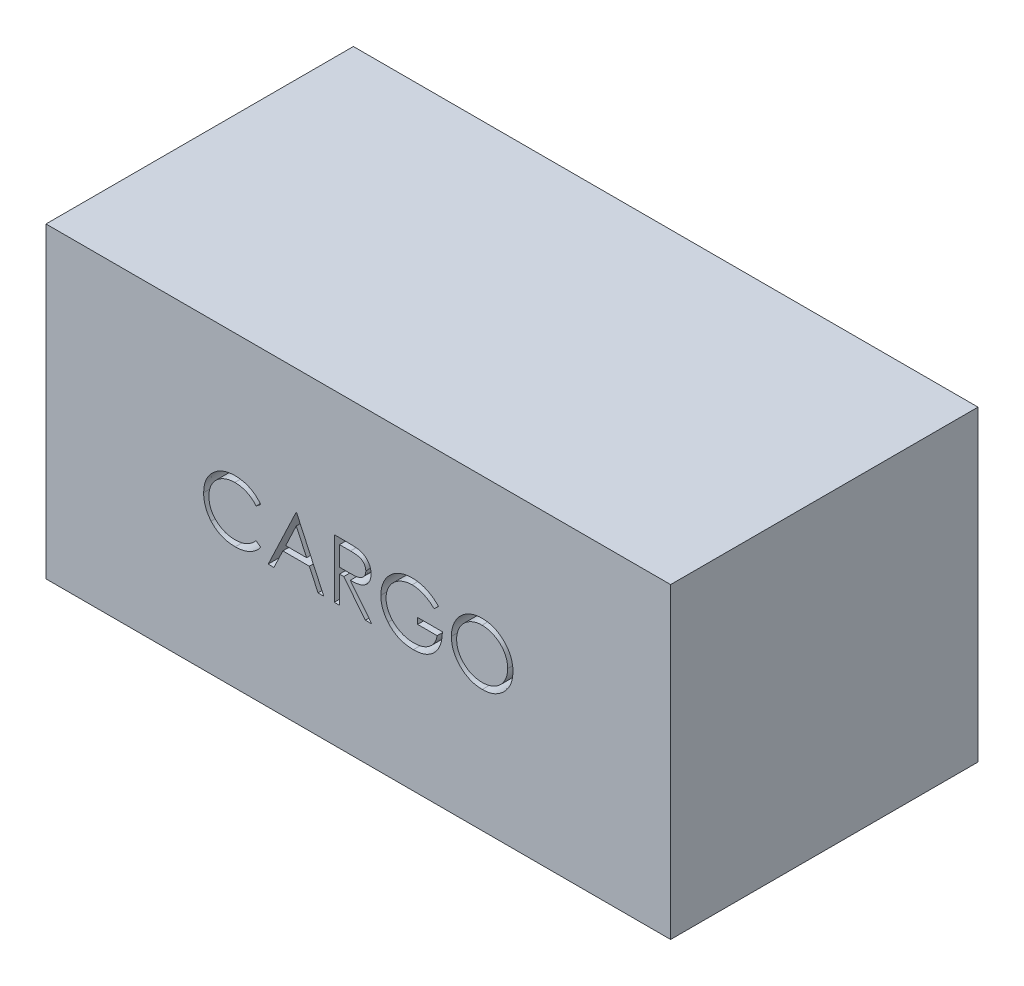
from build123d import *

# Parameters (mm, degrees)
SKETCH1_W           = 203.2
SKETCH1_H           = 100
BOSS_EXTRUDE1_DEPTH = 100
CUT_EXTRUDE1_DEPTH  = 10


with BuildPart() as part:
    # Sketch1 → Boss-Extrude1 (new body)
    with BuildSketch(Plane(origin=(0, 0, 0), x_dir=(1, 0, 0), z_dir=(0, 1, 0))):
        with Locations((32.552380952, -19.217687075)):
            Rectangle(SKETCH1_W, SKETCH1_H)
    extrude(amount=BOSS_EXTRUDE1_DEPTH)

    # Sketch2 → Cut-Extrude1 (cut)
    # profile 1 of 5: a face of its own
    with BuildSketch(Plane.XY.offset(69.217687075)):
        with BuildLine():
            Line((0.79814617, 55.858937578), (-0.697767292, 54.714105847))
            add(Edge.make_bspline(
                [(-0.697767292, 54.714105847), (-0.804479341, 54.841283483), (-1.016464731, 55.093924124), (-1.357509819, 55.448687073), (-1.712937332, 55.781056568), (-2.082611406, 56.092615941), (-2.473186042, 56.372470052), (-2.875199818, 56.635202769), (-3.29537775, 56.870702886), (-3.876412191, 57.156251424), (-4.636495479, 57.454226925), (-5.593321675, 57.704071656), (-6.592146368, 57.86311834), (-7.273579018, 57.88034412), (-7.620183157, 57.889105847)],
                knots=[0, 0, 0, 0, 0.757959112, 1.505699292, 2.245454638, 2.979532153, 3.711538275, 4.438200793, 5.171680507, 5.909471876, 7.393775596, 8.890124382, 10.418191784, 12, 12, 12, 12], degree=3))
            add(Edge.make_bspline(
                [(-7.620183157, 57.889105847), (-7.811136544, 57.886907137), (-8.191271089, 57.882530123), (-8.755414923, 57.82478617), (-9.30902453, 57.743626584), (-9.851739796, 57.62320161), (-10.382869899, 57.47095064), (-10.905887116, 57.289020887), (-11.413219095, 57.063932402), (-11.911884077, 56.815148873), (-12.389653783, 56.534148066), (-12.841710543, 56.227642537), (-13.266405626, 55.899062169), (-13.664074986, 55.547175433), (-14.035125162, 55.173567048), (-14.376867525, 54.774255417), (-14.688119544, 54.350517159), (-14.97505078, 53.907939898), (-15.232022943, 53.447812775), (-15.447178429, 52.968432748), (-15.637706309, 52.478008988), (-15.78846933, 51.971000526), (-15.907801343, 51.450974901), (-15.990139053, 50.916536469), (-16.047226303, 50.368801728), (-16.051581552, 49.997548183), (-16.053776907, 49.810409934)],
                knots=[0, 0, 0, 0, 1.054917814, 2.100044995, 3.131103042, 4.146048494, 5.169673617, 6.183595914, 7.203665975, 8.234915748, 9.262203917, 10.264457458, 11.251630812, 12.227803204, 13.197192746, 14.159520551, 15.12972552, 16.100847026, 17.073214652, 18.039054194, 19.002613845, 19.979014051, 20.95965708, 21.949030935, 22.966165397, 24, 24, 24, 24], degree=3))
            add(Edge.make_bspline(
                [(-16.053776907, 49.810409934), (-16.046909007, 49.52884375), (-16.033424795, 48.976025895), (-15.913418862, 48.166288715), (-15.731055437, 47.390569047), (-15.457739225, 46.653715906), (-15.120722678, 45.946643271), (-14.694870207, 45.281314655), (-14.201657339, 44.647675925), (-13.634106571, 44.060702166), (-13.011412058, 43.524506033), (-12.343312711, 43.052335011), (-11.631472516, 42.658735436), (-10.883751143, 42.331206356), (-10.094394723, 42.079437595), (-9.264822727, 41.902195723), (-8.396839438, 41.786577569), (-7.803734562, 41.775508495), (-7.501883878, 41.769875078)],
                knots=[0, 0, 0, 0, 1.029171465, 2.020641659, 2.987623507, 3.938342917, 4.889210282, 5.84687017, 6.821220943, 7.821438502, 8.827599549, 9.822697543, 10.807740252, 11.797342354, 12.80366471, 13.83203677, 14.896651826, 16, 16, 16, 16], degree=3))
            add(Edge.make_bspline(
                [(-7.501883878, 41.769875078), (-7.169310671, 41.779066865), (-6.514727041, 41.7971585), (-5.554781069, 41.950425271), (-4.635832116, 42.198934795), (-3.757830753, 42.546722058), (-2.923252178, 42.998834553), (-2.130790356, 43.546918715), (-1.379776379, 44.196188069), (-0.928175543, 44.691940524), (-0.697767292, 44.944875078)],
                knots=[0, 0, 0, 0, 1.028121516, 2.023589091, 2.998037872, 3.967518031, 4.937445131, 5.927275754, 6.942489185, 8, 8, 8, 8], degree=3))
            Line((-0.697767292, 44.944875078), (0.79814617, 43.811491664))
            add(Edge.make_bspline(
                [(0.79814617, 43.811491664), (0.677760457, 43.656160948), (0.437565673, 43.346243539), (0.048629895, 42.90933609), (-0.361093681, 42.498378412), (-0.794648331, 42.116683787), (-1.247046597, 41.756614482), (-1.726411611, 41.428400229), (-2.226441631, 41.127459844), (-2.745442437, 40.851904727), (-3.282862601, 40.607426568), (-3.838058169, 40.398128203), (-4.408636015, 40.217834161), (-4.994622225, 40.069505763), (-5.597232273, 39.953730292), (-6.214291568, 39.876334633), (-6.847131889, 39.823310785), (-7.274077338, 39.818477986), (-7.490435561, 39.816028924)],
                knots=[0, 0, 0, 0, 0.986787822, 1.968848986, 2.935600012, 3.899624008, 4.868462664, 5.837806735, 6.815139263, 7.798259679, 8.787526145, 9.778297419, 10.776456485, 11.791383307, 12.812564526, 13.85620153, 14.913611965, 16, 16, 16, 16], degree=3))
            add(Edge.make_bspline(
                [(-7.490435561, 39.816028924), (-7.695324663, 39.817454912), (-8.100467491, 39.820274627), (-8.698630696, 39.865951995), (-9.2809597, 39.928271278), (-9.845790164, 40.022106848), (-10.396204399, 40.132838185), (-10.927212724, 40.281271739), (-11.444040368, 40.447546488), (-11.944610909, 40.642972202), (-12.429350132, 40.863495995), (-12.896694591, 41.112732909), (-13.346429344, 41.388587058), (-13.782975992, 41.6849779), (-14.199885697, 42.011425786), (-14.600771314, 42.36339704), (-14.987880792, 42.739705355), (-15.22738112, 43.0110582), (-15.34779734, 43.147489261)],
                knots=[0, 0, 0, 0, 1.114604814, 2.203992996, 3.262667896, 4.300477797, 5.318619304, 6.316056647, 7.298880507, 8.271930387, 9.238335007, 10.195173496, 11.151986948, 12.108099108, 13.064862484, 14.031167946, 15.010108607, 16, 16, 16, 16], degree=3))
            add(Edge.make_bspline(
                [(-15.34779734, 43.147489261), (-15.540668485, 43.384477732), (-15.924082266, 43.855593541), (-16.414623487, 44.619150096), (-16.834526609, 45.416355633), (-17.174029835, 46.251398388), (-17.439438425, 47.122404596), (-17.623304644, 48.029813325), (-17.742784091, 48.972777124), (-17.756447235, 49.614145931), (-17.763392292, 49.94015753)],
                knots=[0, 0, 0, 0, 0.994628077, 1.977248131, 2.950237994, 3.925870899, 4.908910175, 5.911660606, 6.938484602, 8, 8, 8, 8], degree=3))
            add(Edge.make_bspline(
                [(-17.763392292, 49.94015753), (-17.754927596, 50.28281507), (-17.738273834, 50.956972388), (-17.596782433, 51.946342048), (-17.369168699, 52.894223233), (-17.04587992, 53.798846471), (-16.636003651, 54.664969854), (-16.129673081, 55.485976983), (-15.532770493, 56.267118421), (-14.849977303, 56.996541568), (-14.101217949, 57.663505758), (-13.299382691, 58.250279524), (-12.446040951, 58.738599147), (-11.550593787, 59.146792545), (-10.606336006, 59.460543123), (-9.615282239, 59.680179754), (-8.579294718, 59.81688863), (-7.872472087, 59.834170833), (-7.513332196, 59.842952001)],
                knots=[0, 0, 0, 0, 1.032925535, 2.032216505, 3.007276963, 3.968222605, 4.92396291, 5.891752235, 6.871517503, 7.883894988, 8.900124299, 9.891468569, 10.874487609, 11.85992873, 12.854644235, 13.869047385, 14.917252991, 16, 16, 16, 16], degree=3))
            add(Edge.make_bspline(
                [(-7.513332196, 59.842952001), (-7.29445057, 59.840327792), (-6.861196435, 59.835133434), (-6.220285569, 59.784481432), (-5.596303761, 59.700043089), (-4.98882113, 59.585111338), (-4.394882319, 59.442468631), (-3.819026723, 59.256647864), (-3.257875298, 59.044177601), (-2.714967127, 58.799475094), (-2.192907047, 58.52479183), (-1.691857656, 58.223172507), (-1.215798925, 57.894991051), (-0.76138105, 57.543038625), (-0.336205673, 57.159869324), (0.071798946, 56.756022409), (0.4487771, 56.319865452), (0.681476633, 56.012861454), (0.79814617, 55.858937578)],
                knots=[0, 0, 0, 0, 1.096760587, 2.17092713, 3.219439832, 4.250915756, 5.268269357, 6.278326846, 7.281116186, 8.274029601, 9.260640565, 10.235837813, 11.203064059, 12.156899882, 13.114053108, 14.069676657, 15.032185724, 16, 16, 16, 16], degree=3))
        make_face()
    # profile 2 of 5: a face of its own
    with BuildSketch(Plane.XY.offset(69.217687075)):
        Polygon((12.521223093, 59.354490462), (21.313530785, 40.304490462), (19.455087275, 40.304490462), (16.638801218, 46.410259693), (8.002953862, 46.410259693), (5.110345689, 40.304490462), (3.240453862, 40.304490462), (12.276992323, 59.354490462), align=None)
        Polygon((12.380027179, 55.637603443), (8.93408367, 48.364105847), (15.738200256, 48.364105847), align=None, mode=Mode.SUBTRACT)
    # profile 3 of 5: a face of its own
    with BuildSketch(Plane.XY.offset(69.217687075)):
        with BuildLine():
            Line((24.732761554, 59.354490462), (28.545051218, 59.354490462))
            add(Edge.make_bspline(
                [(28.545051218, 59.354490462), (28.799456503, 59.35364363), (29.287942832, 59.352017618), (29.987748775, 59.342951109), (30.623621974, 59.316964973), (31.195229957, 59.29460254), (31.702562236, 59.253824973), (32.14717449, 59.214850594), (32.527018958, 59.163831098), (32.756957091, 59.116448724), (32.861066843, 59.09499527)],
                knots=[0, 0, 0, 0, 1.410062039, 2.707475311, 3.878576406, 4.937260626, 5.877586885, 6.699081471, 7.410979367, 8, 8, 8, 8], degree=3))
            add(Edge.make_bspline(
                [(32.861066843, 59.09499527), (33.00044004, 59.06055959), (33.276213225, 58.992422837), (33.673270013, 58.848407009), (34.051626548, 58.681748767), (34.409711163, 58.486003375), (34.745730255, 58.259717788), (35.06314849, 58.006798436), (35.363406226, 57.728629216), (35.634360528, 57.418196722), (35.88984308, 57.092515147), (36.105318319, 56.740341842), (36.291063873, 56.372069814), (36.438949115, 55.983953726), (36.5580278, 55.57975751), (36.641990617, 55.155819917), (36.692343509, 54.714072324), (36.697469895, 54.412767135), (36.700069247, 54.259989261)],
                knots=[0, 0, 0, 0, 1.027469482, 2.033020251, 3.019912614, 3.986113645, 4.951240523, 5.91722682, 6.890402269, 7.87763091, 8.8651537, 9.85103654, 10.82876324, 11.815024772, 12.821070561, 13.842952187, 14.906261191, 16, 16, 16, 16], degree=3))
            add(Edge.make_bspline(
                [(36.700069247, 54.259989261), (36.6920737, 54.006161048), (36.676472317, 53.510876463), (36.531011395, 52.792087951), (36.292742052, 52.12158611), (35.964411008, 51.500215181), (35.546293576, 50.94008724), (35.043782927, 50.448104905), (34.456598727, 50.036407666), (33.909976308, 49.750914543), (33.427117592, 49.568073141), (33.029607704, 49.439423816), (32.595991727, 49.340026548), (32.130424234, 49.250980688), (31.630967766, 49.18375218), (31.098819409, 49.134512858), (30.533599641, 49.103738679), (30.145311278, 49.099155767), (29.945562035, 49.096798155)],
                knots=[0, 0, 0, 0, 1.260483769, 2.459530307, 3.627416485, 4.787058657, 5.939039949, 7.08810263, 8.267026773, 9.491475466, 10.141966685, 10.831826277, 11.566392101, 12.351337768, 13.187381173, 14.07005841, 15.007169909, 16, 16, 16, 16], degree=3))
            Line((29.945562035, 49.096798155), (36.944300016, 40.304490462))
            Line((36.944300016, 40.304490462), (34.83017742, 40.304490462))
            Line((34.83017742, 40.304490462), (27.831439439, 49.096798155))
            Line((27.831439439, 49.096798155), (26.442376939, 49.096798155))
            Line((26.442376939, 49.096798155), (26.442376939, 40.304490462))
            Line((26.442376939, 40.304490462), (24.732761554, 40.304490462))
            Line((24.732761554, 40.304490462), (24.732761554, 59.354490462))
        make_face()
        with BuildLine():
            Line((26.442376939, 57.400644309), (26.442376939, 51.050644309))
            Line((26.442376939, 51.050644309), (29.930297612, 51.023931568))
            add(Edge.make_bspline(
                [(29.930297612, 51.023931568), (30.093148109, 51.023859523), (30.408798756, 51.023719879), (30.865458089, 51.045457432), (31.290654697, 51.070186065), (31.682762219, 51.10801036), (32.041955822, 51.156756979), (32.368055971, 51.217733221), (32.661594982, 51.288773734), (33.003942741, 51.398728297), (33.386230148, 51.572932482), (33.801691379, 51.826381839), (34.155489818, 52.145165188), (34.454399897, 52.509692142), (34.694590088, 52.910483725), (34.863928555, 53.342735677), (34.971383848, 53.79553566), (34.984057789, 54.106747933), (34.990453862, 54.263805366)],
                knots=[0, 0, 0, 0, 1.146690395, 2.22261258, 3.21895312, 4.145990853, 4.996080663, 5.770904154, 6.481378293, 7.121626537, 8.300444488, 9.431385265, 10.535395872, 11.636531494, 12.74115979, 13.810798291, 14.895190096, 16, 16, 16, 16], degree=3))
            add(Edge.make_bspline(
                [(34.990453862, 54.263805366), (34.983910889, 54.417003146), (34.970945103, 54.720585245), (34.865088234, 55.1650267), (34.68607603, 55.5844911), (34.444836421, 55.977272082), (34.150926734, 56.333810445), (33.806296925, 56.638867092), (33.420370077, 56.890596321), (33.059665412, 57.051456592), (32.737262055, 57.150080365), (32.457337763, 57.219483128), (32.141045291, 57.275242309), (31.786848867, 57.319917612), (31.396260562, 57.358316665), (30.967305447, 57.384179918), (30.502829543, 57.399495378), (30.180901246, 57.400252419), (30.014251939, 57.400644309)],
                knots=[0, 0, 0, 0, 1.101028733, 2.181837193, 3.264309656, 4.369019818, 5.486613113, 6.575447106, 7.666700264, 8.788928104, 9.402425223, 10.0903467, 10.862060571, 11.710948788, 12.657782767, 13.684531032, 14.801375019, 16, 16, 16, 16], degree=3))
            Line((30.014251939, 57.400644309), (26.442376939, 57.400644309))
        make_face(mode=Mode.SUBTRACT)
    # profile 4 of 5: a face of its own
    with BuildSketch(Plane.XY.offset(69.217687075)):
        with BuildLine():
            Line((58.680838477, 56.103168347), (57.215453862, 54.714105847))
            add(Edge.make_bspline(
                [(57.215453862, 54.714105847), (56.950283914, 54.963556687), (56.426267146, 55.45651007), (55.571954968, 56.096105629), (54.680612903, 56.644016831), (53.756892027, 57.089820775), (52.823667613, 57.445526515), (51.893326702, 57.698772535), (50.975412242, 57.860275917), (50.364902096, 57.879589185), (50.06407165, 57.889105847)],
                knots=[0, 0, 0, 0, 1.08915593, 2.152340314, 3.188132944, 4.216796309, 5.218260357, 6.173443236, 7.099959455, 8, 8, 8, 8], degree=3))
            add(Edge.make_bspline(
                [(50.06407165, 57.889105847), (49.879478784, 57.886854649), (49.5107718, 57.882358092), (48.963100933, 57.824967435), (48.421173951, 57.742427246), (47.886013869, 57.623000741), (47.356580153, 57.471640002), (46.834714154, 57.282307695), (46.31944238, 57.061571294), (45.815618425, 56.806505545), (45.327173684, 56.526308095), (44.865854336, 56.215801038), (44.428719979, 55.884936339), (44.023986807, 55.525430293), (43.649326719, 55.140539384), (43.295822009, 54.737423389), (42.975905584, 54.305068842), (42.686937958, 53.851430506), (42.429155435, 53.384475876), (42.201596907, 52.908699461), (42.01056847, 52.425679339), (41.859423292, 51.934809402), (41.734723876, 51.439887191), (41.646998042, 50.937485784), (41.597540312, 50.427067239), (41.588985338, 50.085270733), (41.584684631, 49.913444789)],
                knots=[0, 0, 0, 0, 1.02818874, 2.053710826, 3.065248034, 4.081641283, 5.106893873, 6.131558223, 7.173050175, 8.228653731, 9.27666206, 10.308777013, 11.325269123, 12.329503258, 13.32196095, 14.316845687, 15.314881793, 16.315733098, 17.311955233, 18.285320748, 19.252783886, 20.203351036, 21.145449891, 22.095197417, 23.042428769, 24, 24, 24, 24], degree=3))
            add(Edge.make_bspline(
                [(41.584684631, 49.913444789), (41.588797898, 49.737799341), (41.597013199, 49.386988075), (41.649592938, 48.86341748), (41.74717379, 48.347622932), (41.877626605, 47.837909522), (42.040807902, 47.333404301), (42.244221984, 46.836294498), (42.485153324, 46.346598511), (42.764026558, 45.868728625), (43.069840037, 45.403239027), (43.412430234, 44.964765058), (43.776342839, 44.547467856), (44.174835636, 44.160612627), (44.595130573, 43.793851706), (45.049784818, 43.457289794), (45.52985821, 43.144444036), (46.036083178, 42.859257266), (46.562966894, 42.604485093), (47.103207221, 42.377932173), (47.658530046, 42.191354637), (48.226016971, 42.039291528), (48.804991493, 41.914648482), (49.398392476, 41.834461696), (50.001856789, 41.776273031), (50.408648486, 41.772018512), (50.613590881, 41.769875078)],
                knots=[0, 0, 0, 0, 0.93586088, 1.869166235, 2.799637598, 3.729985548, 4.670839027, 5.622275134, 6.589130586, 7.576015415, 8.568469353, 9.55398029, 10.53834874, 11.515998671, 12.510579167, 13.508179873, 14.527009472, 15.561807829, 16.601455013, 17.643573243, 18.680854198, 19.719860599, 20.772568776, 21.833555941, 22.908541556, 24, 24, 24, 24], degree=3))
            add(Edge.make_bspline(
                [(50.613590881, 41.769875078), (50.860578743, 41.775038043), (51.345579536, 41.785176365), (52.058520031, 41.864099368), (52.743248173, 41.987362631), (53.397839936, 42.167879869), (54.023055606, 42.398132728), (54.621187187, 42.675693332), (55.1875255, 43.011207696), (55.723773059, 43.389888315), (56.217751455, 43.811790475), (56.663271759, 44.267055295), (57.053227921, 44.753472915), (57.39343207, 45.268178417), (57.674874889, 45.815432149), (57.905884959, 46.392552239), (58.082959018, 46.999798268), (58.155648238, 47.419397006), (58.192376939, 47.631413539)],
                knots=[0, 0, 0, 0, 1.13008108, 2.219097802, 3.278683437, 4.311054135, 5.322181354, 6.324827112, 7.324222904, 8.330512327, 9.32562643, 10.293043162, 11.24128371, 12.174520618, 13.111833804, 14.052305215, 15.015860969, 16, 16, 16, 16], degree=3))
            Line((58.192376939, 47.631413539), (51.842376939, 47.631413539))
            Line((51.842376939, 47.631413539), (51.842376939, 49.585259693))
            Line((51.842376939, 49.585259693), (59.901992323, 49.585259693))
            add(Edge.make_bspline(
                [(59.901992323, 49.585259693), (59.892707634, 49.22109179), (59.874535821, 48.50834942), (59.747070008, 47.468925517), (59.541240135, 46.487188158), (59.260060437, 45.562103439), (58.89606784, 44.694982313), (58.453168792, 43.884944384), (57.924274819, 43.137222735), (57.32822513, 42.445713159), (56.659298217, 41.828878447), (55.935569014, 41.286737556), (55.155841801, 40.830067607), (54.320854134, 40.458534573), (53.433339489, 40.168571829), (52.491244165, 39.962986533), (51.495845739, 39.839814875), (50.813656112, 39.82407751), (50.464762756, 39.816028924)],
                knots=[0, 0, 0, 0, 1.140356446, 2.231883559, 3.274166699, 4.278491846, 5.25512956, 6.21435461, 7.1637429, 8.11826594, 9.068280886, 10.0076534, 10.945064095, 11.891975133, 12.864533718, 13.863980011, 14.907571808, 16, 16, 16, 16], degree=3))
            add(Edge.make_bspline(
                [(50.464762756, 39.816028924), (50.249714734, 39.81912657), (49.825570724, 39.825236125), (49.199147245, 39.868655687), (48.589995624, 39.93549711), (47.998204604, 40.036435568), (47.421597342, 40.160068185), (46.863053601, 40.31838304), (46.320445691, 40.501636961), (45.79293494, 40.710074841), (45.285309336, 40.951583429), (44.795307865, 41.219968753), (44.320221952, 41.513846902), (43.863287754, 41.83830022), (43.422124471, 42.190901896), (42.999576728, 42.572358655), (42.593278992, 42.981504321), (42.338768469, 43.272038644), (42.210525977, 43.41843277)],
                knots=[0, 0, 0, 0, 1.107784379, 2.184907829, 3.233506516, 4.263428166, 5.276301166, 6.270063455, 7.25232949, 8.225834625, 9.190232166, 10.146266622, 11.1027726, 12.066435141, 13.031522626, 14.010570082, 14.99756817, 16, 16, 16, 16], degree=3))
            add(Edge.make_bspline(
                [(42.210525977, 43.41843277), (42.024456833, 43.650683039), (41.655407102, 44.111328461), (41.180364564, 44.849379587), (40.775408357, 45.613566854), (40.446834925, 46.406017617), (40.190269055, 47.225990647), (40.006266451, 48.072438161), (39.898458205, 48.94645015), (39.882926809, 49.537899662), (39.875069247, 49.837122674)],
                knots=[0, 0, 0, 0, 1.023165419, 2.029347347, 3.013907458, 3.994755782, 4.975994455, 5.96558838, 6.970761222, 8, 8, 8, 8], degree=3))
            add(Edge.make_bspline(
                [(39.875069247, 49.837122674), (39.877966143, 50.061184707), (39.883723117, 50.50646108), (39.953530569, 51.167535853), (40.053686859, 51.816872478), (40.200900113, 52.453940163), (40.386481211, 53.079164384), (40.618093756, 53.692835444), (40.887759547, 54.295315488), (41.201189176, 54.882457541), (41.549991734, 55.446470416), (41.928543648, 55.985083603), (42.342220386, 56.488488371), (42.784266381, 56.963060057), (43.259955713, 57.402836638), (43.764832005, 57.811889726), (44.299284343, 58.190768023), (44.864994122, 58.533503838), (45.453517662, 58.841371544), (46.063444241, 59.111278539), (46.694587673, 59.33434487), (47.342219516, 59.523613585), (48.011241912, 59.663577422), (48.696799906, 59.765079879), (49.402466944, 59.834534), (49.879457332, 59.840119764), (50.121313237, 59.842952001)],
                knots=[0, 0, 0, 0, 1.008945113, 2.00506715, 2.99143336, 3.967273523, 4.948097931, 5.927297278, 6.919902385, 7.919676788, 8.923139349, 9.905703106, 10.883022732, 11.856032218, 12.825136022, 13.798837087, 14.781400844, 15.773989409, 16.776158564, 17.77167057, 18.775803737, 19.789618931, 20.80898985, 21.851988756, 22.910860228, 24, 24, 24, 24], degree=3))
            add(Edge.make_bspline(
                [(50.121313237, 59.842952001), (50.31855282, 59.83979791), (50.709655736, 59.833543719), (51.291637222, 59.790193277), (51.864623202, 59.721483296), (52.429463266, 59.627720357), (52.984233917, 59.500010842), (53.530515556, 59.34718475), (54.069100075, 59.16924783), (54.598299546, 58.957037109), (55.121672257, 58.71617095), (55.642128275, 58.445043608), (56.157889313, 58.13901894), (56.669849798, 57.797188268), (57.18123811, 57.425422523), (57.683965664, 57.013088954), (58.190167403, 56.576447954), (58.515660135, 56.262492068), (58.680838477, 56.103168347)],
                knots=[0, 0, 0, 0, 0.985871117, 1.954866573, 2.915460327, 3.869826059, 4.81536089, 5.759505086, 6.70452669, 7.649098992, 8.607881297, 9.583363685, 10.581137262, 11.603961102, 12.659522466, 13.73993555, 14.853081303, 16, 16, 16, 16], degree=3))
        make_face()
    # profile 5 of 5: a face of its own
    with BuildSketch(Plane.XY.offset(69.217687075)):
        with BuildLine():
            add(Edge.make_bspline(
                [(72.724107708, 59.842952001), (73.07684897, 59.834017663), (73.769661912, 59.816469887), (74.787883855, 59.682145052), (75.759951445, 59.449760144), (76.693783201, 59.140263053), (77.578209259, 58.72739847), (78.419886659, 58.228369305), (79.216812787, 57.637947437), (79.958246306, 56.960696931), (80.636736279, 56.223824132), (81.234502888, 55.437451507), (81.735475944, 54.60633374), (82.146878586, 53.732968362), (82.469632447, 52.819330536), (82.692348956, 51.860549464), (82.834615173, 50.862837337), (82.851247333, 50.182333973), (82.859684631, 49.837122674)],
                knots=[0, 0, 0, 0, 1.065120563, 2.091984664, 3.0946048, 4.079830382, 5.057816894, 6.036188127, 7.030412546, 8.04752943, 9.064399622, 10.05169764, 11.02544977, 11.989514704, 12.962713494, 13.945757189, 14.957906945, 16, 16, 16, 16], degree=3))
            add(Edge.make_bspline(
                [(82.859684631, 49.837122674), (82.85124857, 49.494454287), (82.834620116, 48.819015199), (82.692187198, 47.827634453), (82.468806898, 46.874640805), (82.149875792, 45.961625181), (81.740434259, 45.087624441), (81.236125399, 44.254938306), (80.642085381, 43.463293793), (79.966045235, 42.72136343), (79.229076706, 42.041020054), (78.438609111, 41.448190173), (77.612419755, 40.938063152), (76.739876915, 40.531026298), (75.832552429, 40.205696274), (74.882325785, 39.98388553), (73.893649541, 39.840808909), (73.219437363, 39.824379558), (72.876751939, 39.816028924)],
                knots=[0, 0, 0, 0, 1.043624062, 2.057103931, 3.04512605, 4.022047818, 4.998200453, 5.980619268, 6.982898556, 8.009068085, 9.034988726, 10.034168286, 11.015286542, 11.987931943, 12.962482838, 13.94673481, 14.956375938, 16, 16, 16, 16], degree=3))
            add(Edge.make_bspline(
                [(72.876751939, 39.816028924), (72.531542431, 39.824462015), (71.851042599, 39.841085883), (70.852076735, 39.983587529), (69.892622158, 40.206425197), (68.975422617, 40.5248837), (68.099966643, 40.936457484), (67.26454205, 41.438312748), (66.47250212, 42.033800187), (65.730413472, 42.709621115), (65.051421407, 43.445340562), (64.459459663, 44.233652722), (63.957491546, 45.059091707), (63.547299693, 45.923948231), (63.222554564, 46.82404137), (63.001004054, 47.765375226), (62.857661229, 48.742583107), (62.841142994, 49.40793374), (62.832761554, 49.745536136)],
                knots=[0, 0, 0, 0, 1.053102029, 2.075944431, 3.073151272, 4.055350789, 5.033113405, 6.020478099, 7.024410459, 8.052272461, 9.079885166, 10.07527673, 11.055994387, 12.023226415, 12.992069828, 13.970394897, 14.97016774, 16, 16, 16, 16], degree=3))
            add(Edge.make_bspline(
                [(62.832761554, 49.745536136), (62.835671499, 49.972136806), (62.841454678, 50.422479478), (62.911078033, 51.091224831), (63.012106721, 51.749215411), (63.15689713, 52.394580142), (63.346263204, 53.025739216), (63.569703524, 53.647045511), (63.84260754, 54.252202636), (64.15111221, 54.844077382), (64.495437193, 55.413443269), (64.875760915, 55.951630715), (65.278724849, 56.463155854), (65.720485606, 56.934763118), (66.186483686, 57.380172019), (66.684278573, 57.792537665), (67.210832789, 58.175578469), (67.768412027, 58.520766326), (68.343277209, 58.832963901), (68.935877957, 59.100871405), (69.538165867, 59.330810682), (70.15296188, 59.517178602), (70.778633396, 59.664310112), (71.416545967, 59.764498709), (72.066191387, 59.834299639), (72.503858709, 59.840055471), (72.724107708, 59.842952001)],
                knots=[0, 0, 0, 0, 1.037015668, 2.060948919, 3.074880161, 4.083647147, 5.086022904, 6.090072063, 7.104153813, 8.122640571, 9.144368836, 10.147691507, 11.138137339, 12.123020368, 13.103399296, 14.087645067, 15.080126199, 16.082011238, 17.087798457, 18.072939717, 19.057185487, 20.037253025, 21.01195951, 21.997135196, 22.992090687, 24, 24, 24, 24], degree=3))
        make_face()
        with BuildLine():
            add(Edge.make_bspline(
                [(72.808062035, 57.889105847), (72.62727953, 57.886902087), (72.267442812, 57.882515636), (71.732494122, 57.824735812), (71.204580882, 57.742385988), (70.683594068, 57.624920854), (70.17171355, 57.464878795), (69.664167986, 57.280687566), (69.16558565, 57.056327059), (68.677612509, 56.802838482), (68.204546171, 56.52226507), (67.758162753, 56.212175881), (67.337306648, 55.879842893), (66.943008297, 55.524490521), (66.576425489, 55.144309117), (66.230343042, 54.745062286), (65.918632891, 54.315338422), (65.632961394, 53.86679035), (65.377322149, 53.400002316), (65.14999929, 52.919888637), (64.96404947, 52.422532942), (64.812398536, 51.913331027), (64.686669566, 51.393089353), (64.607019208, 50.857861376), (64.548604508, 50.310336552), (64.544468778, 49.940321032), (64.542376939, 49.753168347)],
                knots=[0, 0, 0, 0, 1.008559885, 2.007477868, 2.99961109, 3.989939068, 4.984837346, 5.991145699, 7.001802488, 8.033829008, 9.059044045, 10.069351652, 11.065060232, 12.050310815, 13.029377138, 14.011219647, 14.996725999, 15.989392538, 16.977580475, 17.965360261, 18.951710183, 19.937753436, 20.929683414, 21.935841486, 22.955955122, 24, 24, 24, 24], degree=3))
            add(Edge.make_bspline(
                [(64.542376939, 49.753168347), (64.54931583, 49.477965402), (64.562966777, 48.936556073), (64.682478694, 48.14316089), (64.866566869, 47.38068036), (65.137933392, 46.65328654), (65.477298881, 45.954726943), (65.89654524, 45.291198545), (66.393255406, 44.662522014), (66.957481172, 44.073086336), (67.574280475, 43.535082744), (68.229234334, 43.062841906), (68.915326112, 42.663280403), (69.634344972, 42.337769938), (70.382452292, 42.079834365), (71.164468677, 41.903057816), (71.97518475, 41.786714266), (72.527801601, 41.775541409), (72.808062035, 41.769875078)],
                knots=[0, 0, 0, 0, 1.032063989, 2.030389145, 3.003944642, 3.970395727, 4.937377036, 5.913328081, 6.909231446, 7.93887556, 8.970685674, 9.976071282, 10.964166581, 11.944589148, 12.933237628, 13.927779006, 14.949070134, 16, 16, 16, 16], degree=3))
            add(Edge.make_bspline(
                [(72.808062035, 41.769875078), (72.996436608, 41.77246318), (73.370039963, 41.777596164), (73.925731306, 41.829296106), (74.471411544, 41.912200995), (75.006315296, 42.03156642), (75.529835484, 42.180957644), (76.044157198, 42.358436849), (76.543802178, 42.579858829), (77.035073581, 42.824504108), (77.505315982, 43.103396966), (77.954218522, 43.402961752), (78.370466356, 43.734805244), (78.76446973, 44.08487791), (79.13255758, 44.460238282), (79.472240766, 44.860398346), (79.782375485, 45.287883924), (80.067938504, 45.735751632), (80.322681977, 46.20381695), (80.544636788, 46.68567134), (80.732938504, 47.180128293), (80.884949366, 47.687900989), (81.004068808, 48.208025037), (81.086146657, 48.741196862), (81.143560302, 49.286349855), (81.147887794, 49.655069986), (81.150069247, 49.84093878)],
                knots=[0, 0, 0, 0, 1.047197238, 2.076906641, 3.100256066, 4.114471768, 5.12198147, 6.126382909, 7.136867548, 8.15857795, 9.17633901, 10.174870724, 11.156907918, 12.133735059, 13.104061851, 14.077631395, 15.04955518, 16.038496417, 17.029181396, 18.010275684, 18.986308667, 19.968651475, 20.955262928, 21.950658345, 22.966943676, 24, 24, 24, 24], degree=3))
            add(Edge.make_bspline(
                [(81.150069247, 49.84093878), (81.147886046, 50.025536024), (81.143555265, 50.391718663), (81.086174082, 50.933069689), (81.003982093, 51.462405026), (80.885530782, 51.977646582), (80.732857802, 52.478925697), (80.544603904, 52.965771567), (80.322615346, 53.439997886), (80.067844867, 53.900432559), (79.781464457, 54.342255062), (79.468531504, 54.764633907), (79.123642966, 55.15963697), (78.756652745, 55.537015805), (78.358394069, 55.888721747), (77.930670983, 56.214871467), (77.478676108, 56.523336003), (77.000100727, 56.801605132), (76.50619435, 57.058585456), (75.999388379, 57.278754487), (75.485424279, 57.465837023), (74.965609039, 57.625405075), (74.4355674, 57.741925925), (73.898880846, 57.824810025), (73.356291896, 57.882495525), (72.991385228, 57.886895414), (72.808062035, 57.889105847)],
                knots=[0, 0, 0, 0, 1.02996197, 2.043119294, 3.035359645, 4.018872909, 4.991431989, 5.957985074, 6.929999688, 7.912076566, 8.892894881, 9.867085534, 10.843653904, 11.817741046, 12.803660682, 13.806313499, 14.818574707, 15.856120519, 16.894564902, 17.924820532, 18.937903209, 19.946497019, 20.957711757, 21.963978472, 22.977135795, 24, 24, 24, 24], degree=3))
        make_face(mode=Mode.SUBTRACT)
    extrude(amount=-CUT_EXTRUDE1_DEPTH, mode=Mode.SUBTRACT)


solid = part.part
